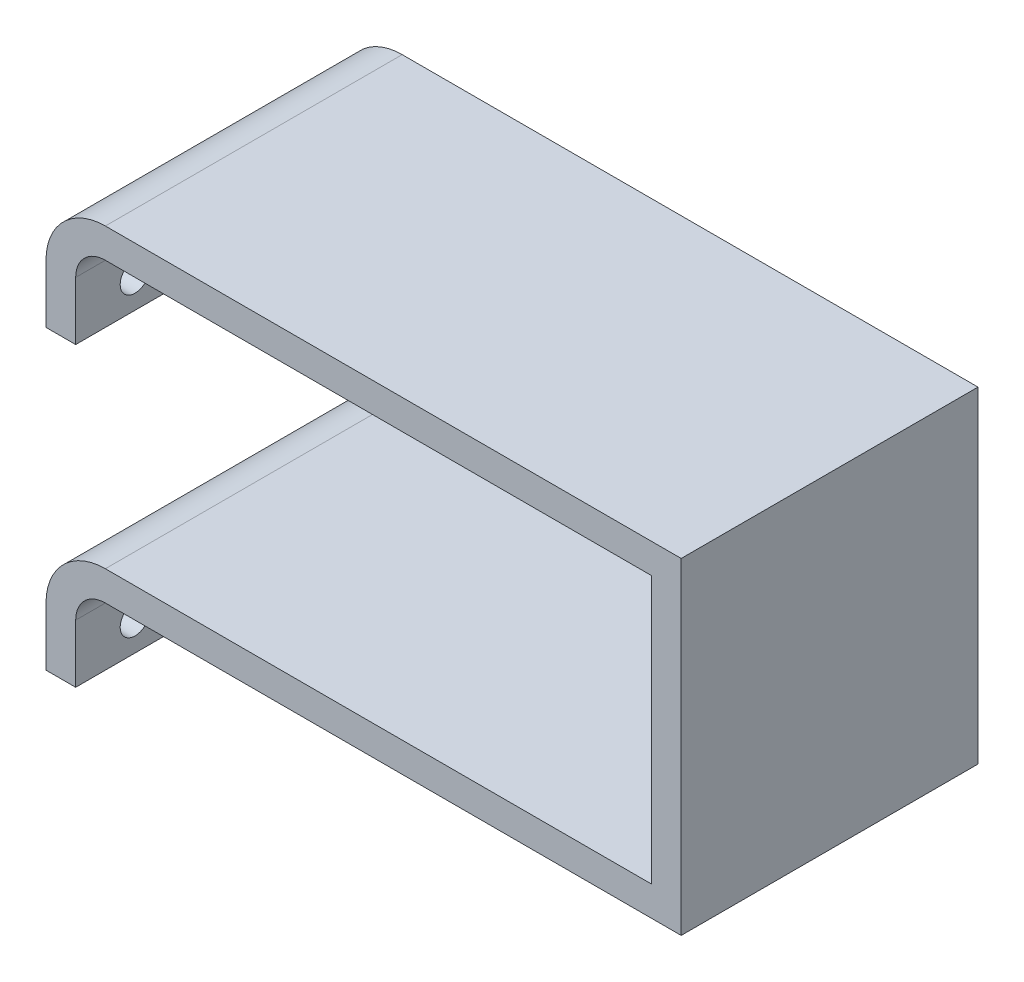
from build123d import *

# Parameters (mm, degrees)
BOSS_EXTRUDE2_DEPTH = 100
SKETCH2_R           = 5
CUT_EXTRUDE1_DEPTH  = 275.379591078
SKETCH3_R           = 5
CUT_EXTRUDE2_DEPTH  = 10


with BuildPart() as part:
    # Sketch1 → Boss-Extrude2 (new body)
    with BuildSketch(Plane.XY):
        with BuildLine():
            Line((0, 0), (0, 19.6))
            ThreePointArc((0, 19.6), (5.857864376, 33.742135624), (20, 39.6))
            Line((20, 39.6), (204, 39.6))
            Line((204, 39.6), (204, 129.6))
            Line((204, 129.6), (20, 129.6))
            ThreePointArc((20, 129.6), (12.928932188, 126.671067812), (10, 119.6))
            Line((10, 119.6), (10, 100))
            Line((10, 100), (0, 100))
            Line((0, 100), (0, 119.6))
            ThreePointArc((0, 119.6), (5.857864376, 133.742135624), (20, 139.6))
            Line((20, 139.6), (214, 139.6))
            Line((214, 139.6), (214, 29.6))
            Line((214, 29.6), (20, 29.6))
            ThreePointArc((20, 29.6), (12.928932188, 26.671067812), (10, 19.6))
            Line((10, 19.6), (10, 0))
            Line((10, 0), (0, 0))
        make_face()
    extrude(amount=BOSS_EXTRUDE2_DEPTH)

    # Sketch2 → Cut-Extrude1 (cut, through all)
    with BuildSketch(Plane.ZY):
        with Locations((20, 10)):
            Circle(SKETCH2_R)
        with Locations(Location((80, 10, 0), (0, 0, 180))):
            Circle(SKETCH2_R)
    extrude(amount=-CUT_EXTRUDE1_DEPTH, mode=Mode.SUBTRACT)

    # Sketch3 → Cut-Extrude2 (cut)
    with BuildSketch(Plane.ZY):
        with Locations((20, 110)):
            Circle(SKETCH3_R)
        with Locations((80, 110)):
            Circle(SKETCH3_R)
    extrude(amount=-CUT_EXTRUDE2_DEPTH, mode=Mode.SUBTRACT)


solid = part.part
